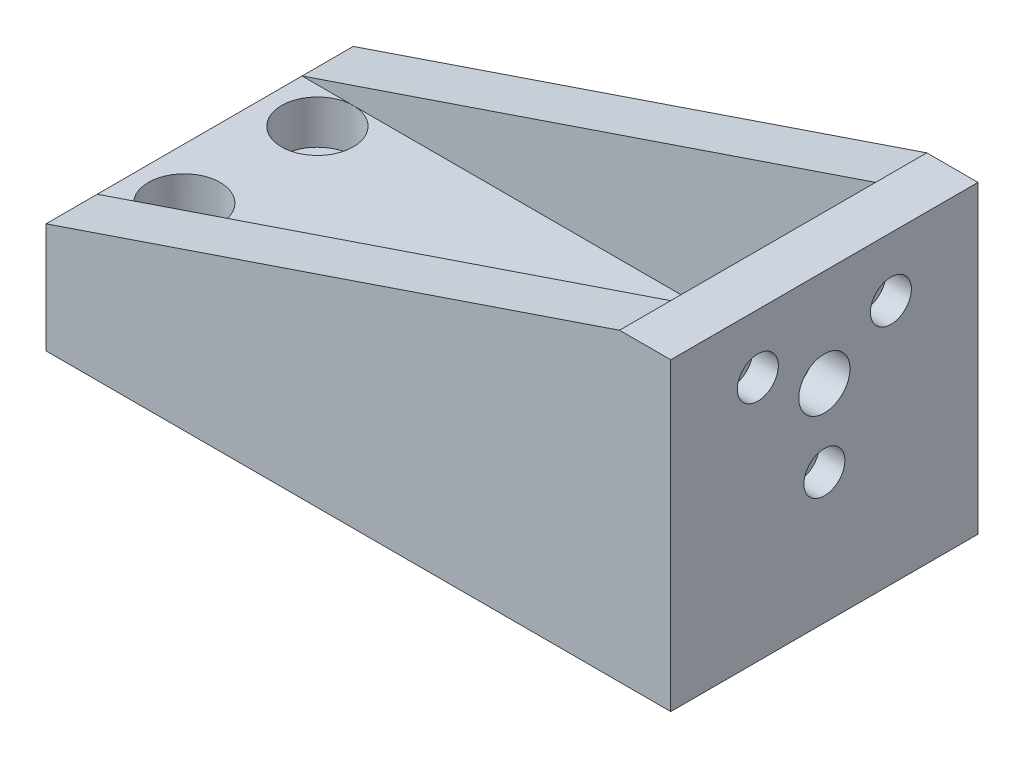
from build123d import *

# Parameters (mm, degrees)
SKETCH5_W           = 30
SKETCH5_H           = 29.75
SKETCH5_R           = 2.5
SKETCH5_R_2         = 1
BOSS_EXTRUDE3_DEPTH = 5
SKETCH10_R          = 2
CUT_EXTRUDE8_DEPTH  = 2.5
SKETCH11_W          = 30
SKETCH11_H          = 10.75
BOSS_EXTRUDE4_DEPTH = 56
BOSS_EXTRUDE5_DEPTH = 5
SKETCH13_R          = 6.25
CUT_EXTRUDE9_DEPTH  = 1.5
SKETCH16_R          = 3.5
CUT_EXTRUDE10_DEPTH = 4.25
SKETCH17_R          = 2
CUT_EXTRUDE11_DEPTH = 6.5


with BuildPart() as part:
    # Sketch5 → Boss-Extrude3 (new body)
    with BuildSketch(Plane(origin=(0, 0, 0), x_dir=(0, 0, -1), z_dir=(1, 0, 0))):
        with Locations((0, -5.375)):
            Rectangle(SKETCH5_W, SKETCH5_H)
        Circle(SKETCH5_R, mode=Mode.SUBTRACT)
        with Locations((6.495190528, 3.75)):
            Circle(SKETCH5_R_2, mode=Mode.SUBTRACT)
        with Locations((0, -7.5)):
            Circle(SKETCH5_R_2, mode=Mode.SUBTRACT)
        with Locations((-6.495190528, 3.75)):
            Circle(SKETCH5_R_2, mode=Mode.SUBTRACT)
    extrude(amount=-BOSS_EXTRUDE3_DEPTH)

    # Sketch10 → Cut-Extrude8 (cut)
    with BuildSketch(Plane(origin=(0, 0, 0), x_dir=(0, 0, -1), z_dir=(1, 0, 0))):
        with Locations((-6.495190528, 3.75)):
            Circle(SKETCH10_R)
        with Locations((6.495190528, 3.75)):
            Circle(SKETCH10_R)
        with Locations((0, -7.5)):
            Circle(SKETCH10_R)
    extrude(amount=-CUT_EXTRUDE8_DEPTH, mode=Mode.SUBTRACT)

    # Sketch11 → Boss-Extrude4 (add)
    with BuildSketch(Plane.ZY.offset(5)):
        with Locations((0, -14.875)):
            Rectangle(SKETCH11_W, SKETCH11_H)
    extrude(amount=BOSS_EXTRUDE4_DEPTH)

    # Sketch12 → Boss-Extrude5 (add)
    with BuildSketch(Plane(origin=(0, 0, -15), x_dir=(-1, 0, 0), z_dir=(0, 0, -1))):
        Polygon((5, -9.5), (61, -9.5), (5, 9.5), align=None)
    boss_extrude5 = extrude(amount=-BOSS_EXTRUDE5_DEPTH)

    # Mirror1: Boss-Extrude5 across plane
    add(boss_extrude5.mirror(Plane.XY))

    # Sketch13 → Cut-Extrude9 (cut)
    with BuildSketch(Plane.ZY.offset(5)):
        Circle(SKETCH13_R)
    extrude(amount=-CUT_EXTRUDE9_DEPTH, mode=Mode.SUBTRACT)

    # Sketch16 → Cut-Extrude10 (cut)
    with BuildSketch(Plane(origin=(0, -9.5, 0), x_dir=(1, 0, 0), z_dir=(0, 1, 0))):
        with Locations(Location((-11, 6.5, 0), (0, 0, 270))):
            Circle(SKETCH16_R)
        with Locations(Location((-56, 6.5, 0), (0, 0, 270))):
            Circle(SKETCH16_R)
        with Locations(Location((-56, -6.5, 0), (0, 0, 270))):
            Circle(SKETCH16_R)
        with Locations(Location((-11, -6.5, 0), (0, 0, 270))):
            Circle(SKETCH16_R)
    extrude(amount=-CUT_EXTRUDE10_DEPTH, mode=Mode.SUBTRACT)

    # Sketch17 → Cut-Extrude11 (cut)
    with BuildSketch(Plane(origin=(0, -13.75, 0), x_dir=(1, 0, 0), z_dir=(0, 1, 0))):
        with Locations(Location((-56, 6.5, 0), (0, 0, 270))):
            Circle(SKETCH17_R)
        with Locations(Location((-11, 6.5, 0), (0, 0, 270))):
            Circle(SKETCH17_R)
        with Locations(Location((-11, -6.5, 0), (0, 0, 270))):
            Circle(SKETCH17_R)
        with Locations(Location((-56, -6.5, 0), (0, 0, 270))):
            Circle(SKETCH17_R)
    extrude(amount=-CUT_EXTRUDE11_DEPTH, mode=Mode.SUBTRACT)


solid = part.part
